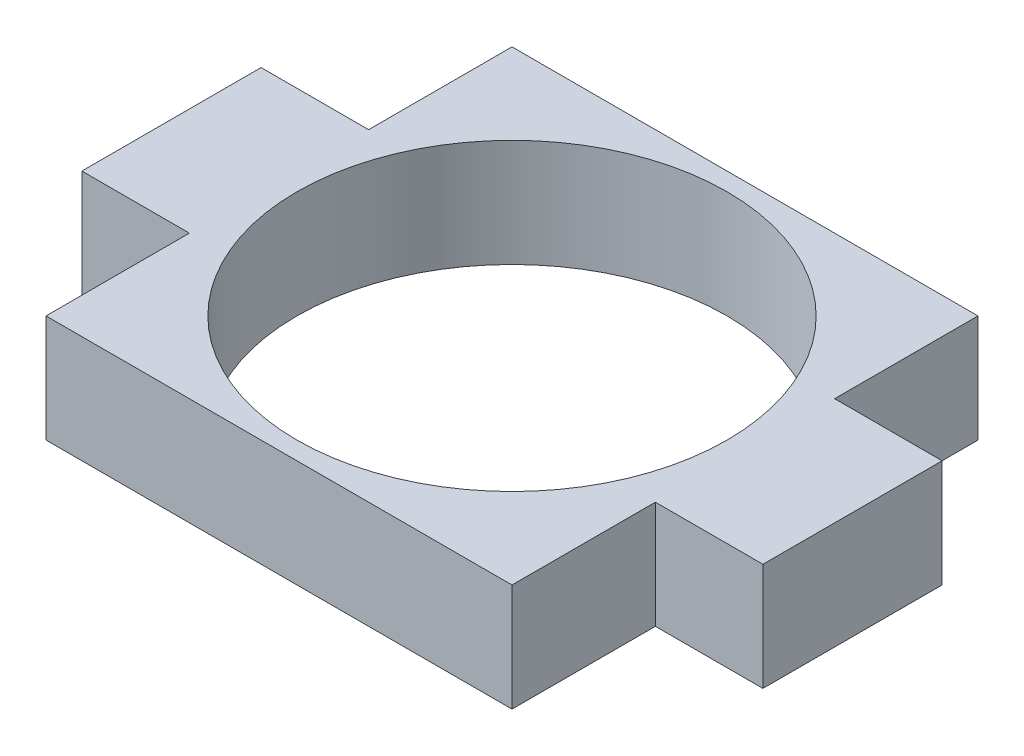
from build123d import *

# Parameters (mm, degrees)
SKETCH1_W           = 13
SKETCH1_H           = 13
BOSS_EXTRUDE1_DEPTH = 3
SKETCH2_R           = 6
CUT_EXTRUDE1_DEPTH  = 3
SKETCH4_W           = 3
SKETCH4_H           = 5
BOSS_EXTRUDE2_DEPTH = 3


with BuildPart() as part:
    # Sketch1 → Boss-Extrude1 (new body)
    with BuildSketch(Plane(origin=(0, 0, 0), x_dir=(1, 0, 0), z_dir=(0, 1, 0))):
        Rectangle(SKETCH1_W, SKETCH1_H)
    extrude(amount=BOSS_EXTRUDE1_DEPTH)

    # Sketch2 → Cut-Extrude1 (cut)
    with BuildSketch(Plane(origin=(0, 3, 0), x_dir=(1, 0, 0), z_dir=(0, 1, 0))):
        with Locations(Location((0, 0, 0), (0, 0, 270))):
            Circle(SKETCH2_R)
    extrude(amount=-CUT_EXTRUDE1_DEPTH, mode=Mode.SUBTRACT)

    # Sketch4 → Boss-Extrude2 (add)
    with BuildSketch(Plane(origin=(0, 3, 0), x_dir=(1, 0, 0), z_dir=(0, 1, 0))):
        with Locations((-8, 0)):
            Rectangle(SKETCH4_W, SKETCH4_H)
        with Locations((8, 0)):
            Rectangle(SKETCH4_W, SKETCH4_H)
    extrude(amount=-BOSS_EXTRUDE2_DEPTH)


solid = part.part
